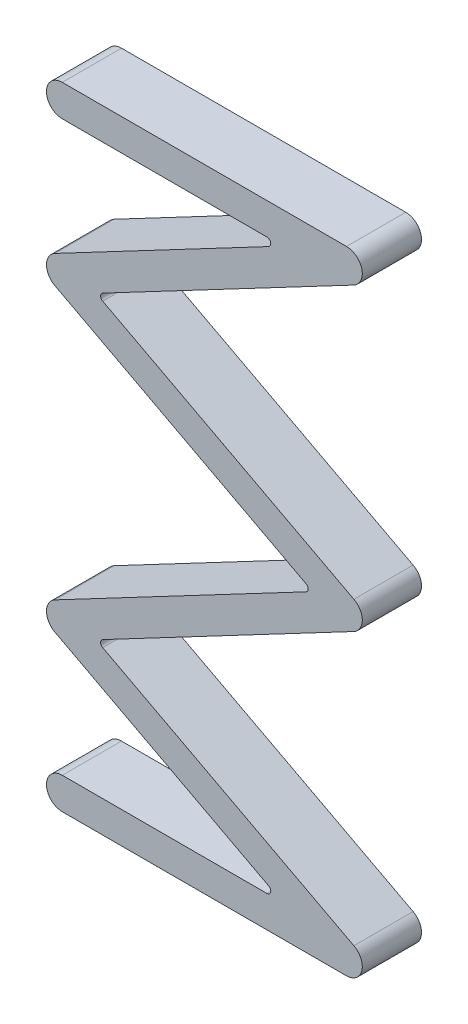
from build123d import *

# Parameters (mm, degrees)
BOSS_EXTRUDE1_DEPTH = 1.5
FILLET1_R           = 0.4
FILLET2_R           = 0.1


with BuildPart() as part:
    # Sketch2 → Boss-Extrude1 (new body)
    with BuildSketch(Plane.XY):
        with BuildLine():
            Line((0.4, 15.2), (5.985131266, 15.2))
            Line((5.985131266, 15.2), (-0.456973997, 11.8))
            Line((-0.456973997, 11.8), (6.743026003, 8))
            Line((6.743026003, 8), (-0.456973997, 4.2))
            Line((-0.456973997, 4.2), (5.985131266, 0.8))
            Line((5.985131266, 0.8), (0.4, 0.8))
            ThreePointArc((0.4, 0.8), (0, 0.4), (0.4, 0))
            Line((0.4, 0), (9.214868734, 0))
            Line((9.214868734, 0), (1.256973997, 4.2))
            Line((1.256973997, 4.2), (8.456973997, 8))
            Line((8.456973997, 8), (1.256973997, 11.8))
            Line((1.256973997, 11.8), (9.214868734, 16))
            Line((9.214868734, 16), (0.4, 16))
            ThreePointArc((0.4, 16), (0, 15.6), (0.4, 15.2))
        make_face()
    extrude(amount=BOSS_EXTRUDE1_DEPTH)

    # Fillet1
    fillet1_edges = [part.edges().sort_by_distance(p)[0] for p in [
        (9.214868734, 16, 0.75),
        (8.456973997, 8, 0.75),
        (9.214868734, 0, 0.75),
        (-0.456973997, 4.2, 0.75),
        (-0.456973997, 11.8, 0.75),
    ]]
    fillet(fillet1_edges, radius=FILLET1_R)

    # Fillet2
    fillet2_edges = [part.edges().sort_by_distance(p)[0] for p in [
        (1.256973997, 11.8, 0.75),
        (1.256973997, 4.2, 0.75),
        (5.985131266, 0.8, 0.75),
        (6.743026003, 8, 0.75),
        (5.985131266, 15.2, 0.75),
    ]]
    fillet(fillet2_edges, radius=FILLET2_R)


solid = part.part
